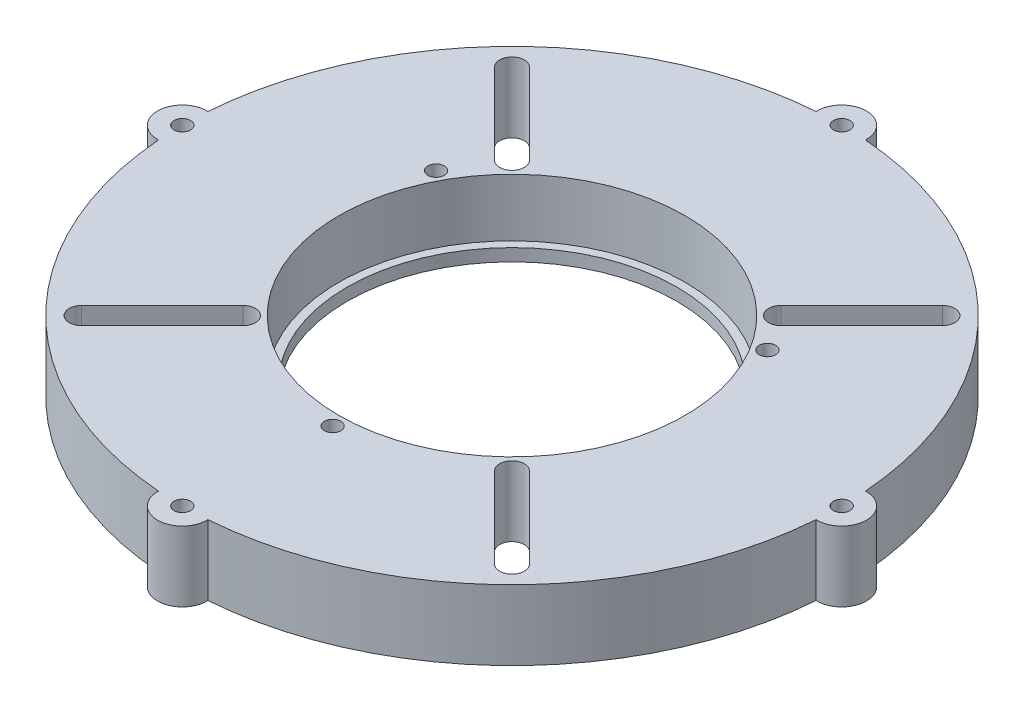
from build123d import *

# Parameters (mm, degrees)
SKETCH1_R                                    = 40
SKETCH1_R_2                                  = 20
BOSS_EXTRUDE1_DEPTH                          = 8.5
SKETCH2_R                                    = 1
CUT_EXTRUDE2_DEPTH                           = 58.203583804
SKETCH2_6_R                                  = 3
SKETCH2_6_R_2                                = 1
BOSS_EXTRUDE3_DEPTH                          = 8.5
CIRPATTERN1_COUNT                            = 4
CUT_EXTRUDE4_DEPTH                           = 62.402361518
CIRPATTERN3_COUNT                            = 4
SKETCH7_R                                    = 21
CUT_EXTRUDE5_DEPTH                           = 7
SKETCH8_R                                    = 1
OUTER_RETAINER_M2_TAPPED_ENVELOPE_DEPTH      = 4.3
SKETCH9_R                                    = 1
REVB_OLDHAM_FOUR_M2_BLIND_THREAD_MAJOR_DEPTH = 5.8
SKETCH10_R                                   = 1.51
REVB_OLDHAM_FOUR_D3P02_PILOT_POCKETS_DEPTH   = 1.1


with BuildPart() as part:
    # Sketch1 → Boss-Extrude1 (new body)
    with BuildSketch(Plane(origin=(0, 0, 0), x_dir=(1, 0, 0), z_dir=(0, 1, 0))):
        Circle(SKETCH1_R)
        Circle(SKETCH1_R_2, mode=Mode.SUBTRACT)
    extrude(amount=BOSS_EXTRUDE1_DEPTH)

    # Sketch2 → Cut-Extrude2 (cut, through all)
    with BuildSketch(Plane(origin=(0, 8.5, 0), x_dir=(1, 0, 0), z_dir=(0, 1, 0))):
        with Locations((40, 0)):
            Circle(SKETCH2_R)
    cut_extrude2 = extrude(amount=-CUT_EXTRUDE2_DEPTH, mode=Mode.SUBTRACT)

    # Sketch2<6> → Boss-Extrude3 (add)
    with BuildSketch(Plane(origin=(0, 8.5, 0), x_dir=(1, 0, 0), z_dir=(0, 1, 0))):
        with Locations((40, 0)):
            Circle(SKETCH2_6_R)
        with Locations((40, 0)):
            Circle(SKETCH2_6_R_2, mode=Mode.SUBTRACT)
    boss_extrude3 = extrude(amount=-BOSS_EXTRUDE3_DEPTH)

    # CirPattern1: Cut-Extrude2, Boss-Extrude3 ×4 about axis
    cirpattern1_axis = Axis((0, 8.5, 0), (0, 1, 0))
    add([cut_extrude2.rotate(cirpattern1_axis, i * 360 / CIRPATTERN1_COUNT) for i in range(1, CIRPATTERN1_COUNT)], mode=Mode.SUBTRACT)
    add([boss_extrude3.rotate(cirpattern1_axis, i * 360 / CIRPATTERN1_COUNT) for i in range(1, CIRPATTERN1_COUNT)])

    # Sketch4 → Cut-Extrude4 (cut, through all)
    with BuildSketch(Plane(origin=(0, 8.5, 0), x_dir=(1, 0, 0), z_dir=(0, 1, 0))):
        with BuildLine():
            Line((-27.170578067, -25.049257724), (-17.377149148, -15.255828804))
            ThreePointArc((-17.377149148, -15.255828804), (-15.255828804, -15.255828804), (-15.255828804, -17.377149148))
            Line((-15.255828804, -17.377149148), (-25.049257724, -27.170578067))
            ThreePointArc((-25.049257724, -27.170578067), (-27.170578067, -27.170578067), (-27.170578067, -25.049257724))
        make_face()
    cut_extrude4 = extrude(amount=-CUT_EXTRUDE4_DEPTH, mode=Mode.SUBTRACT)

    # CirPattern3: Cut-Extrude4 ×4 about axis
    cirpattern3_axis = Axis((0, 8.5, 0), (0, 1, 0))
    for i in range(1, CIRPATTERN3_COUNT):
        add(cut_extrude4.rotate(cirpattern3_axis, i * 360 / CIRPATTERN3_COUNT), mode=Mode.SUBTRACT)

    # Sketch7 → Cut-Extrude5 (cut)
    with BuildSketch(Plane(origin=(0, 8.5, 0), x_dir=(1, 0, 0), z_dir=(0, 1, 0))):
        Circle(SKETCH7_R)
    extrude(amount=-CUT_EXTRUDE5_DEPTH, mode=Mode.SUBTRACT)

    # Sketch8 → Outer_Retainer_M2_Tapped_Envelope (cut)
    with BuildSketch(Plane(origin=(0, 8.5, 0), x_dir=(1, 0, 0), z_dir=(0, 1, 0))):
        with Locations((0.720053396, -22.48847534)):
            Circle(SKETCH8_R)
        with Locations((19.115564239, 11.867822203)):
            Circle(SKETCH8_R)
        with Locations((-19.835617634, 10.620653137)):
            Circle(SKETCH8_R)
    extrude(amount=-OUTER_RETAINER_M2_TAPPED_ENVELOPE_DEPTH, mode=Mode.SUBTRACT)

    # Sketch9 → RevB_Oldham_Four_M2_Blind_Thread_Major (cut)
    with BuildSketch(Plane.XZ):
        with Locations((27.716385975, 11.480502971)):
            Circle(SKETCH9_R)
        with Locations((-11.480502971, 27.716385975)):
            Circle(SKETCH9_R)
        with Locations((-27.716385975, -11.480502971)):
            Circle(SKETCH9_R)
        with Locations((11.480502971, -27.716385975)):
            Circle(SKETCH9_R)
    extrude(amount=-REVB_OLDHAM_FOUR_M2_BLIND_THREAD_MAJOR_DEPTH, mode=Mode.SUBTRACT)

    # Sketch10 → RevB_Oldham_Four_D3p02_Pilot_Pockets (cut)
    with BuildSketch(Plane.XZ):
        with Locations((27.716385975, 11.480502971)):
            Circle(SKETCH10_R)
        with Locations((-11.480502971, 27.716385975)):
            Circle(SKETCH10_R)
        with Locations((-27.716385975, -11.480502971)):
            Circle(SKETCH10_R)
        with Locations((11.480502971, -27.716385975)):
            Circle(SKETCH10_R)
    extrude(amount=-REVB_OLDHAM_FOUR_D3P02_PILOT_POCKETS_DEPTH, mode=Mode.SUBTRACT)


solid = part.part
